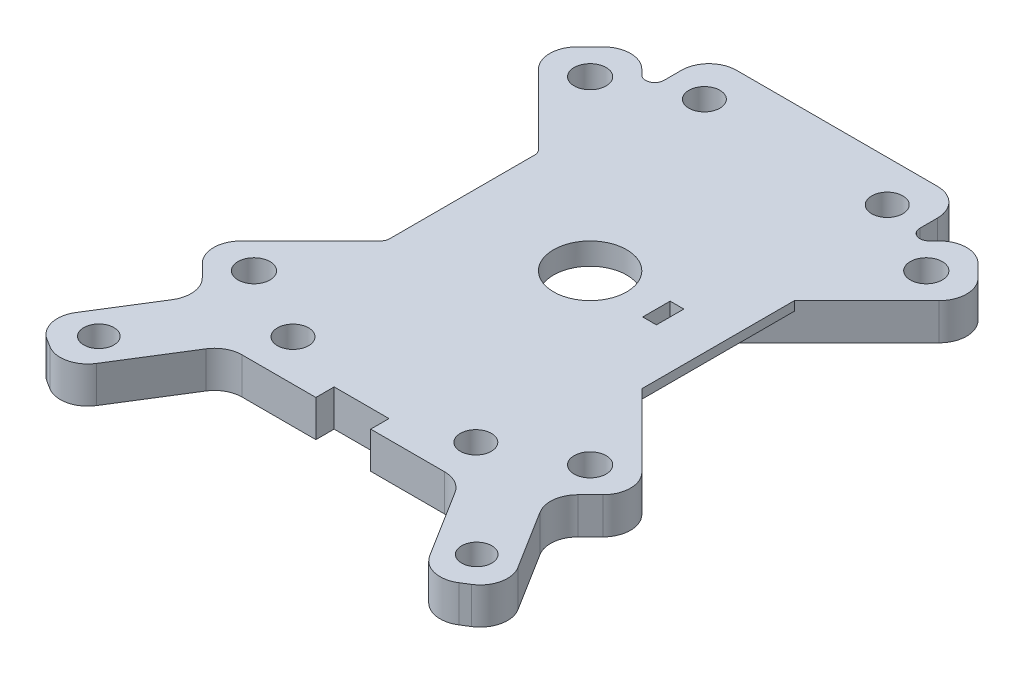
from build123d import *

# Parameters (mm, degrees)
SKETCH1_W           = 28
SKETCH1_H           = 54
BOSS_EXTRUDE1_DEPTH = 4
BOSS_EXTRUDE4_DEPTH = 4
SKETCH2_R           = 1.75
BOSS_EXTRUDE2_DEPTH = 4
SKETCH3_R           = 1.7
CUT_EXTRUDE1_DEPTH  = 4
CUT_EXTRUDE2_REACH  = 48.344
SKETCH4_R           = 4
SKETCH4_W           = 1.5
SKETCH4_H           = 3
CUT_EXTRUDE3_DEPTH  = 1.6
CHAMFER1_SIZE       = 3
FILLET1_R           = 3
FILLET2_R           = 1
SKETCH7_W           = 6
SKETCH7_H           = 4
CUT_EXTRUDE4_DEPTH  = 2
CUT_EXTRUDE5_DEPTH  = 1
CUT_EXTRUDE6_REACH  = 46.778
SKETCH9_R           = 1.65


with BuildPart() as part:
    # Sketch1 → Boss-Extrude1 (new body)
    with BuildSketch(Plane(origin=(0, 0, 0), x_dir=(1, 0, 0), z_dir=(0, 1, 0))):
        Rectangle(SKETCH1_W, SKETCH1_H)
    extrude(amount=BOSS_EXTRUDE1_DEPTH)

    # Sketch10 → Boss-Extrude4 (add)
    with BuildSketch(Plane(origin=(0, 0, 0), x_dir=(1, 0, 0), z_dir=(0, 1, 0))):
        Polygon((2.968168337, 1.854717425), (0, 0), (2.968168337, -1.854717425), (0, -6.604779702), (19.818360025, -38.32078556), (25.754696699, -34.61135071), align=None)
        Polygon((0, -6.604779702), (-2.968168337, -1.854717425), (0, 0), (-2.968168337, 1.854717425), (-25.754696699, -34.61135071), (-19.818360025, -38.32078556), align=None)
    extrude(amount=BOSS_EXTRUDE4_DEPTH)

    # Sketch2 → Boss-Extrude2 (add)
    # profile 1 of 4: a face of its own
    with BuildSketch(Plane(origin=(0, 0, 0), x_dir=(1, 0, 0), z_dir=(0, 1, 0))):
        Polygon((14, 19.656854249), (14, 8.343145751), (24.04163056, 18.384776311), (18.384776311, 24.04163056), align=None)
        with Locations(Location((18.384776311, 18.384776311, 0), (0, 0, 270))):
            Circle(SKETCH2_R, mode=Mode.SUBTRACT)
    # profile 2 of 4: a face of its own
    with BuildSketch(Plane(origin=(0, 0, 0), x_dir=(1, 0, 0), z_dir=(0, 1, 0))):
        Polygon((24.04163056, -18.384776311), (14, -8.343145751), (14, -15.799903705), (18.85572261, -23.570684261), align=None)
        with Locations(Location((18.384776311, -18.384776311, 0), (0, 0, 270))):
            Circle(SKETCH2_R, mode=Mode.SUBTRACT)
    # profile 3 of 4: a face of its own
    with BuildSketch(Plane(origin=(0, 0, 0), x_dir=(1, 0, 0), z_dir=(0, 1, 0))):
        Polygon((-24.04163056, -18.384776311), (-18.85572261, -23.570684261), (-14, -15.799903705), (-14, -8.343145751), align=None)
        with Locations(Location((-18.384776311, -18.384776311, 0), (0, 0, 270))):
            Circle(SKETCH2_R, mode=Mode.SUBTRACT)
    # profile 4 of 4: a face of its own
    with BuildSketch(Plane(origin=(0, 0, 0), x_dir=(1, 0, 0), z_dir=(0, 1, 0))):
        Polygon((-14, 8.343145751), (-14, 19.656854249), (-18.384776311, 24.04163056), (-24.04163056, 18.384776311), align=None)
        with Locations(Location((-18.384776311, 18.384776311, 0), (0, 0, 270))):
            Circle(SKETCH2_R, mode=Mode.SUBTRACT)
    extrude(amount=BOSS_EXTRUDE2_DEPTH)

    # Sketch3 → Cut-Extrude1 (cut)
    with BuildSketch(Plane(origin=(0, 4, 0), x_dir=(1, 0, 0), z_dir=(0, 1, 0))):
        with Locations(Location((10, -22.5, 0), (0, 0, 270))):
            Circle(SKETCH3_R)
        with Locations(Location((-10, -22.5, 0), (0, 0, 270))):
            Circle(SKETCH3_R)
        with Locations(Location((-10, 22.5, 0), (0, 0, 270))):
            Circle(SKETCH3_R)
        with Locations(Location((10, 22.5, 0), (0, 0, 270))):
            Circle(SKETCH3_R)
    extrude(amount=-CUT_EXTRUDE1_DEPTH, mode=Mode.SUBTRACT)

    # Sketch4 → Cut-Extrude2 (cut, up to next)
    with BuildSketch(Plane(origin=(0, 4, 0), x_dir=(1, 0, 0), z_dir=(0, 1, 0)), mode=Mode.PRIVATE) as cut_extrude2_sk1:
        with Locations(Location((0, 0, 0), (0, 0, 270))):
            Circle(SKETCH4_R)
    cut_extrude2_tool1 = extrude(cut_extrude2_sk1.sketch, amount=-CUT_EXTRUDE2_REACH, mode=Mode.PRIVATE) & part.part
    # Sketch4 → Cut-Extrude2 (cut, up to next)
    with BuildSketch(Plane(origin=(0, 4, 0), x_dir=(1, 0, 0), z_dir=(0, 1, 0)), mode=Mode.PRIVATE) as cut_extrude2_sk2:
        with Locations((8, 0)):
            Rectangle(SKETCH4_W, SKETCH4_H)
    cut_extrude2_tool2 = extrude(cut_extrude2_sk2.sketch, amount=-CUT_EXTRUDE2_REACH, mode=Mode.PRIVATE) & part.part
    add(cut_extrude2_tool1.solids().sort_by_distance((0, 4, 0))[0], mode=Mode.SUBTRACT)
    add(cut_extrude2_tool2.solids().sort_by_distance((8, 4, 0))[0], mode=Mode.SUBTRACT)

    # Sketch5 → Cut-Extrude3 (cut)
    with BuildSketch(Plane.XZ):
        with BuildLine():
            Line((6.708203932, -6), (-6.708203932, -6))
            ThreePointArc((-6.708203932, -6), (-9, 0), (-6.708203932, 6))
            Line((-6.708203932, 6), (6.708203932, 6))
            ThreePointArc((6.708203932, 6), (9, 0), (6.708203932, -6))
        make_face()
    extrude(amount=-CUT_EXTRUDE3_DEPTH, mode=Mode.SUBTRACT)

    # Chamfer1
    chamfer1_edges = [part.edges().sort_by_distance(p)[0] for p in [
        (14, 0, 0),
    ]]
    chamfer(chamfer1_edges, length=CHAMFER1_SIZE)

    # Fillet1
    fillet1_edges = [part.edges().sort_by_distance(p)[0] for p in [
        (18.384776311, 2, -24.04163056),
        (24.04163056, 2, -18.384776311),
        (18.85572261, 2, 23.570684261),
        (24.04163056, 2, 18.384776311),
        (-18.85572261, 2, 23.570684261),
        (-24.04163056, 2, 18.384776311),
        (12.74434809, 2, 27),
        (25.754696699, 2, 34.61135071),
        (19.818360025, 2, 38.32078556),
        (-19.818360025, 2, 38.32078556),
        (-25.754696699, 2, 34.61135071),
        (-12.74434809, 2, 27),
        (-14, 2, -27),
        (-24.04163056, 2, -18.384776311),
        (14, 2, -27),
        (-18.384776311, 2, -24.04163056),
    ]]
    fillet(fillet1_edges, radius=FILLET1_R)

    # Fillet2
    fillet2_edges = [part.edges().sort_by_distance(p)[0] for p in [
        (14, 2, -19.656854249),
        (-14, 2, 8.343145751),
        (-14, 2, -19.656854249),
        (-14, 2, -8.343145751),
    ]]
    fillet(fillet2_edges, radius=FILLET2_R)

    # Sketch7 → Cut-Extrude4 (cut)
    with BuildSketch(Plane.XY.offset(27)):
        with Locations((0, 2)):
            Rectangle(SKETCH7_W, SKETCH7_H)
    extrude(amount=-CUT_EXTRUDE4_DEPTH, mode=Mode.SUBTRACT)

    # Sketch8 → Cut-Extrude5 (cut)
    with BuildSketch(Plane(origin=(0, 0, 0), x_dir=(-1, 0, 0), z_dir=(0, 1, 0))):
        Polygon((-5, -27), (5, -27), (6.5, -6), (-6.5, -6), align=None)
    extrude(amount=CUT_EXTRUDE5_DEPTH, mode=Mode.SUBTRACT)

    # Sketch9 → Cut-Extrude6 (cut, up to next)
    with BuildSketch(Plane(origin=(0, 4, 0), x_dir=(1, 0, 0), z_dir=(0, 1, 0)), mode=Mode.PRIVATE) as cut_extrude6_sk1:
        with Locations(Location((20.666851305, -33.07387575, 0), (0, 0, 270))):
            Circle(SKETCH9_R)
    cut_extrude6_tool1 = extrude(cut_extrude6_sk1.sketch, amount=-CUT_EXTRUDE6_REACH, mode=Mode.PRIVATE) & part.part
    # Sketch9 → Cut-Extrude6 (cut, up to next)
    with BuildSketch(Plane(origin=(0, 4, 0), x_dir=(1, 0, 0), z_dir=(0, 1, 0)), mode=Mode.PRIVATE) as cut_extrude6_sk2:
        with Locations(Location((-20.666851305, -33.07387575, 0), (0, 0, 90))):
            Circle(SKETCH9_R)
    cut_extrude6_tool2 = extrude(cut_extrude6_sk2.sketch, amount=-CUT_EXTRUDE6_REACH, mode=Mode.PRIVATE) & part.part
    add(cut_extrude6_tool1.solids().sort_by_distance((20.666851, 4, 33.073876))[0], mode=Mode.SUBTRACT)
    add(cut_extrude6_tool2.solids().sort_by_distance((-20.666851, 4, 33.073876))[0], mode=Mode.SUBTRACT)


solid = part.part
